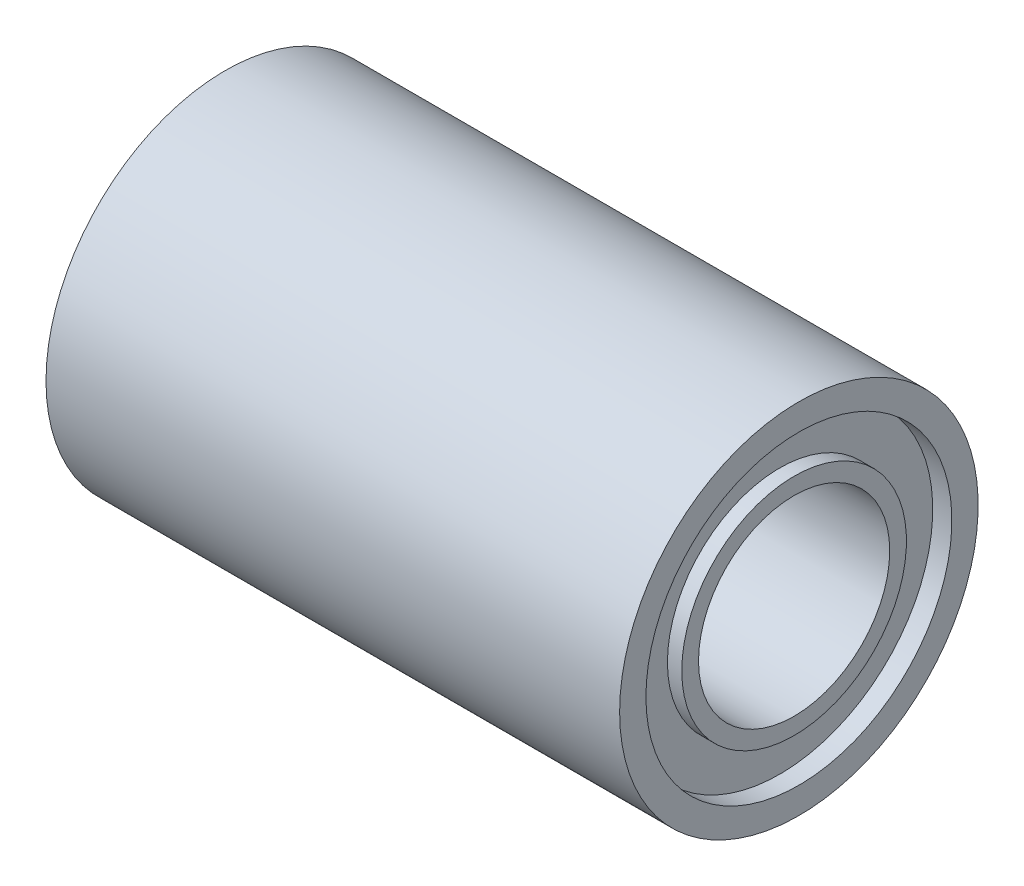
from build123d import *


with BuildPart() as part:
    # Sketch1 → Revolve1 (revolve)
    with BuildSketch(Plane.XY, mode=Mode.PRIVATE) as revolve1_sk:
        Polygon((-12, 7.5), (12, 7.5), (12, 6.4), (11.2, 6.4), (11.2, 4.7), (11.8, 4.7), (11.8, 4), (-11.8, 4), (-11.8, 4.7), (-11.2, 4.7), (-11.2, 6.4), (-12, 6.4), align=None)
    revolve(revolve1_sk.sketch.rotate(Axis((-30.2753079, 0, 0), (1, 0, 0)), 90), axis=Axis((-30.2753079, 0, 0), (1, 0, 0)))


solid = part.part
